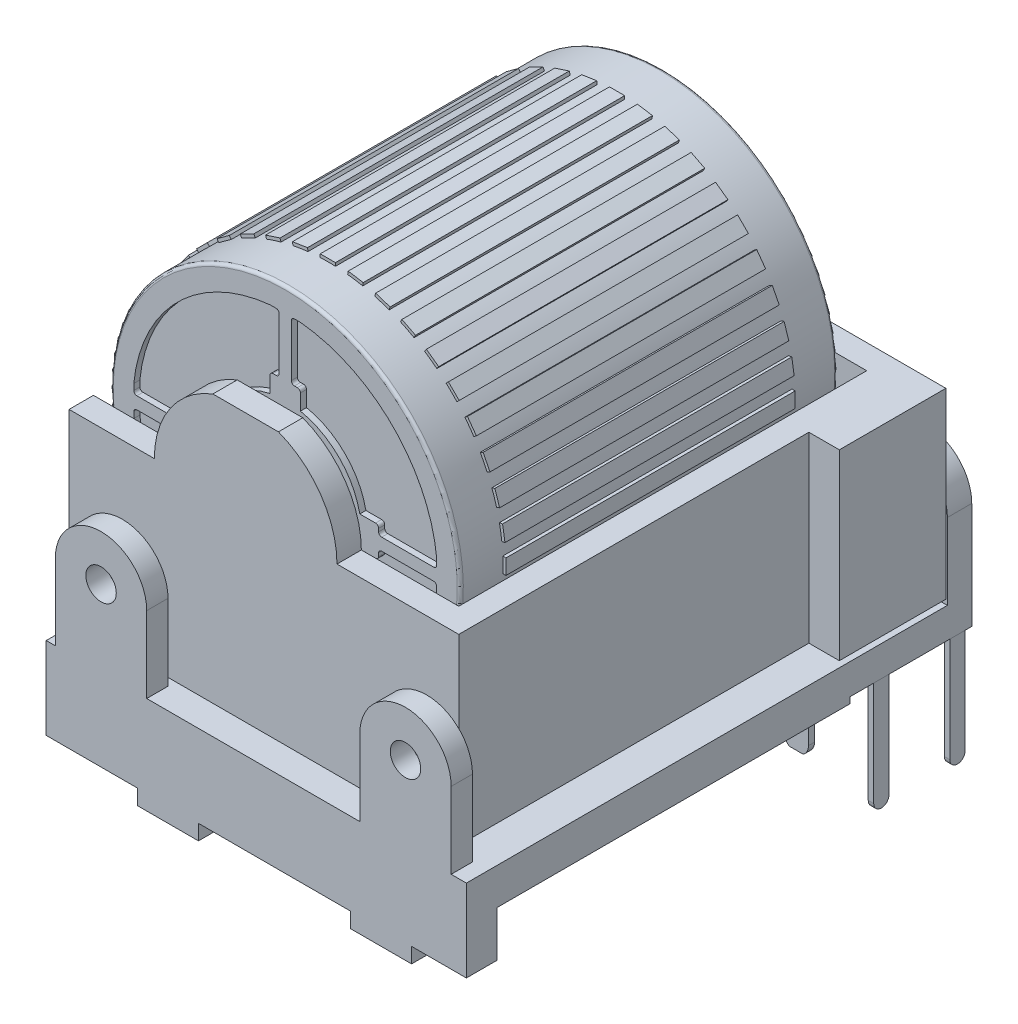
from build123d import *

# Parameters (mm, degrees)
SKETCH_1_W          = 13.8
SKETCH_1_H          = 16.6
EXTRUDE_1_DEPTH     = 1.2
SKETCH_2_W          = 13.8
SKETCH_2_H          = 1
EXTRUDE_2_DEPTH     = 1.5
SKETCH_3_W          = 2
SKETCH_3_H          = 2.2
EXTRUDE_3_DEPTH     = 0.5
SKETCH_4_R          = 0.5
EXTRUDE_4_DEPTH     = 0.7
SKETCH_5_R          = 0.5
EXTRUDE_5_DEPTH     = 0.8
CUT_EXTRUDE_1_DEPTH = 23.204504048
SKETCH_7_W          = 1.3
SKETCH_7_H          = 4
CUT_EXTRUDE_2_DEPTH = 0.2
CUT_EXTRUDE_3_DEPTH = 23.158519806
SKETCH_9_W          = 0.18
SKETCH_9_H          = 0.5
EXTRUDE_6_DEPTH     = 3.7
CUT_EXTRUDE_5_DEPTH = 3.7
CUT_EXTRUDE_4_DEPTH = 3.7
SKETCH_12_R         = 0.5
EXTRUDE_7_DEPTH     = 0.2
EXTRUDE_8_DEPTH     = 6
SKETCH_14_W         = 12
SKETCH_14_H         = 13.4
CUT_EXTRUDE_6_DEPTH = 2.8
SKETCH_15_R         = 0.6
EXTRUDE_9_DEPTH     = 1.2
FILLET_1_R          = 0.1
EXTRUDE_10_DEPTH    = 0.8
EXTRUDE_START       = -0.8
EXTRUDE_11_DEPTH    = 0.8
SKETCH_18_R         = 2
EXTRUDE_12_DEPTH    = 0.5
EXTRUDE_START_2     = 0.5
SKETCH_19_R         = 2
EXTRUDE_13_DEPTH    = 0.5
SKETCH_20_R         = 5.75
EXTRUDE_14_DEPTH    = 12.4
FILLET_2_R          = 0.1
FILLET_3_R          = 0.1
SKETCH_21_R         = 4.85
SKETCH_21_R_2       = 4
EXTRUDE_15_DEPTH    = 0.1
SKETCH_22_R         = 4
EXTRUDE_16_DEPTH    = 0.2
CUT_EXTRUDE_7_DEPTH = 0.2
EXTRUDE_17_DEPTH    = 9.5


with BuildPart() as part:
    # 草图1 → 凸台-拉伸1 (new body)
    with BuildSketch(Plane(origin=(0, 0, 0), x_dir=(1, 0, 0), z_dir=(0, 1, 0))):
        with Locations((6.9, 8.3)):
            Rectangle(SKETCH_1_W, SKETCH_1_H)
    extrude(amount=EXTRUDE_1_DEPTH)

    # 草图2 → 凸台-拉伸2 (add)
    with BuildSketch(Plane.XZ):
        with Locations((6.9, -0.5)):
            Rectangle(SKETCH_2_W, SKETCH_2_H)
    extrude(amount=EXTRUDE_2_DEPTH)

    # 草图3 → 凸台-拉伸3 (add)
    with BuildSketch(Plane.XZ.offset(1.5)):
        with Locations((11, -1.1)):
            Rectangle(SKETCH_3_W, SKETCH_3_H)
        with Locations((4, -1.1)):
            Rectangle(SKETCH_3_W, SKETCH_3_H)
    extrude(amount=EXTRUDE_3_DEPTH)

    # 草图4 → 凸台-拉伸4 (add)
    # profile 1 of 2: a face of its own
    with BuildSketch(Plane.XY):
        with BuildLine():
            Line((0.3, 1.2), (0.3, 3.7))
            ThreePointArc((0.3, 3.7), (1.8, 5.2), (3.3, 3.7))
            Line((3.3, 3.7), (3.3, 1.2))
            Line((3.3, 1.2), (0.3, 1.2))
        make_face()
        with Locations((1.8, 3.7)):
            Circle(SKETCH_4_R, mode=Mode.SUBTRACT)
    # profile 2 of 2: a face of its own
    with BuildSketch(Plane.XY):
        with BuildLine():
            Line((13.3, 1.2), (13.3, 3.7))
            ThreePointArc((13.3, 3.7), (11.8, 5.2), (10.3, 3.7))
            Line((10.3, 3.7), (10.3, 1.2))
            Line((10.3, 1.2), (13.3, 1.2))
        make_face()
        with Locations((11.8, 3.7)):
            Circle(SKETCH_4_R, mode=Mode.SUBTRACT)
    extrude(amount=-EXTRUDE_4_DEPTH)

    # 草图5 → 凸台-拉伸5 (add)
    with BuildSketch(Plane(origin=(0, 0, -16.6), x_dir=(-1, 0, 0), z_dir=(0, 0, -1))):
        with BuildLine():
            Line((-2, 1.2), (-2, 3.7))
            ThreePointArc((-2, 3.7), (-2.439339828, 4.760660172), (-3.5, 5.2))
            Line((-3.5, 5.2), (-12.3, 5.2))
            ThreePointArc((-12.3, 5.2), (-13.360660172, 4.760660172), (-13.8, 3.7))
            Line((-13.8, 3.7), (-13.8, 1.2))
            Line((-13.8, 1.2), (-2, 1.2))
        make_face()
        with Locations((-12.5, 3.7)):
            Circle(SKETCH_5_R, mode=Mode.SUBTRACT)
        with Locations((-3.3, 3.7)):
            Circle(SKETCH_5_R, mode=Mode.SUBTRACT)
    extrude(amount=-EXTRUDE_5_DEPTH)

    # 草图6 → 切除-拉伸1 (cut, through all)
    with BuildSketch(Plane.XZ):
        Polygon((11, -2.7), (12.5, -2.7), (12.5, -1), (9.5, -1), (9.5, -2.7), align=None)
        Polygon((4, -2.7), (5.5, -2.7), (5.5, -1), (2.5, -1), (2.5, -2.7), align=None)
    extrude(amount=-CUT_EXTRUDE_1_DEPTH, mode=Mode.SUBTRACT)

    # 草图7 → 切除-拉伸2 (cut)
    with BuildSketch(Plane.XZ):
        with Locations((13.15, -14.6)):
            Rectangle(SKETCH_7_W, SKETCH_7_H)
        Polygon((2, -14.8), (2, -11.3), (10, -11.3), (10, -12.3), (12, -12.3), (12, -14.8), align=None)
    extrude(amount=-CUT_EXTRUDE_2_DEPTH, mode=Mode.SUBTRACT)

    # 草图8 → 切除-拉伸3 (cut, through all)
    with BuildSketch(Plane.XZ.offset(-0.2)):
        Polygon((2, -13.05), (12, -13.05), (12, -12.3), (10, -12.3), (10, -11.3), (2, -11.3), align=None)
    extrude(amount=-CUT_EXTRUDE_3_DEPTH, mode=Mode.SUBTRACT)

    # 草图9 → 凸台-拉伸6 (add)
    with BuildSketch(Plane.XZ.offset(-0.2)):
        Polygon((10.81, -14.025), (11.21, -14.025), (11.21, -13.825), (10.41, -13.825), (10.41, -14.025), align=None)
        with Locations((13.69, -16.15)):
            Rectangle(SKETCH_9_W, SKETCH_9_H)
        Polygon((8.27, -14.025), (8.67, -14.025), (8.67, -13.825), (7.87, -13.825), (7.87, -14.025), align=None)
        Polygon((5.73, -14.025), (6.13, -14.025), (6.13, -13.825), (5.33, -13.825), (5.33, -14.025), align=None)
        with Locations((13.69, -13.65)):
            Rectangle(SKETCH_9_W, SKETCH_9_H)
        Polygon((3.19, -14.025), (3.59, -14.025), (3.59, -13.825), (2.79, -13.825), (2.79, -14.025), align=None)
    extrude(amount=EXTRUDE_6_DEPTH)

    # 草图11 → 切除-拉伸5 (cut)
    with BuildSketch(Plane(origin=(13.78, 0, 0), x_dir=(0, 0, -1), z_dir=(1, 0, 0))):
        with BuildLine():
            ThreePointArc((13.65, -3.5), (13.473223305, -3.426776695), (13.4, -3.25))
            Line((13.4, -3.25), (13.4, -3.5))
            Line((13.4, -3.5), (13.65, -3.5))
        make_face()
        with BuildLine():
            ThreePointArc((13.9, -3.25), (13.826776695, -3.426776695), (13.65, -3.5))
            Line((13.65, -3.5), (13.9, -3.5))
            Line((13.9, -3.5), (13.9, -3.25))
        make_face()
        with BuildLine():
            ThreePointArc((16.15, -3.5), (15.973223305, -3.426776695), (15.9, -3.25))
            Line((15.9, -3.25), (15.9, -3.5))
            Line((15.9, -3.5), (16.15, -3.5))
        make_face()
        with BuildLine():
            ThreePointArc((16.4, -3.25), (16.326776695, -3.426776695), (16.15, -3.5))
            Line((16.15, -3.5), (16.4, -3.5))
            Line((16.4, -3.5), (16.4, -3.25))
        make_face()
    extrude(amount=-CUT_EXTRUDE_5_DEPTH, mode=Mode.SUBTRACT)

    # 草图10 → 切除-拉伸4 (cut)
    with BuildSketch(Plane(origin=(0, 0, -14.025), x_dir=(-1, 0, 0), z_dir=(0, 0, -1))):
        with BuildLine():
            ThreePointArc((-10.81, -3.5), (-11.092842712, -3.382842712), (-11.21, -3.1))
            Line((-11.21, -3.1), (-11.21, -3.5))
            Line((-11.21, -3.5), (-10.81, -3.5))
        make_face()
        with BuildLine():
            ThreePointArc((-10.41, -3.1), (-10.527157288, -3.382842712), (-10.81, -3.5))
            Line((-10.81, -3.5), (-10.41, -3.5))
            Line((-10.41, -3.5), (-10.41, -3.1))
        make_face()
        with BuildLine():
            ThreePointArc((-5.33, -3.1), (-5.447157288, -3.382842712), (-5.73, -3.5))
            Line((-5.73, -3.5), (-5.33, -3.5))
            Line((-5.33, -3.5), (-5.33, -3.1))
        make_face()
        with BuildLine():
            ThreePointArc((-5.73, -3.5), (-6.012842712, -3.382842712), (-6.13, -3.1))
            Line((-6.13, -3.1), (-6.13, -3.5))
            Line((-6.13, -3.5), (-5.73, -3.5))
        make_face()
        with BuildLine():
            ThreePointArc((-2.79, -3.1), (-2.907157288, -3.382842712), (-3.19, -3.5))
            Line((-3.19, -3.5), (-2.79, -3.5))
            Line((-2.79, -3.5), (-2.79, -3.1))
        make_face()
        with BuildLine():
            ThreePointArc((-3.19, -3.5), (-3.472842712, -3.382842712), (-3.59, -3.1))
            Line((-3.59, -3.1), (-3.59, -3.5))
            Line((-3.59, -3.5), (-3.19, -3.5))
        make_face()
        with BuildLine():
            Line((-8.67, -3.1), (-8.67, -3.5))
            Line((-8.67, -3.5), (-8.27, -3.5))
            ThreePointArc((-8.27, -3.5), (-8.552842712, -3.382842712), (-8.67, -3.1))
        make_face()
        with BuildLine():
            ThreePointArc((-8.27, -3.5), (-7.987157288, -3.382842712), (-7.87, -3.1))
            Line((-7.87, -3.1), (-7.87, -3.5))
            Line((-7.87, -3.5), (-8.27, -3.5))
        make_face()
    extrude(amount=-CUT_EXTRUDE_4_DEPTH, mode=Mode.SUBTRACT)

    # 草图12 → 凸台-拉伸7 (add)
    with BuildSketch(Plane(origin=(0, 1.2, 0), x_dir=(1, 0, 0), z_dir=(0, 1, 0))):
        with Locations(Location((6.727077824, 7.591019079, 0), (0, 0, 270))):
            Circle(SKETCH_12_R)
    extrude(amount=EXTRUDE_7_DEPTH)

    # 草图13 → 凸台-拉伸8 (add)
    with BuildSketch(Plane(origin=(0, 1.4, 0), x_dir=(1, 0, 0), z_dir=(0, 1, 0))):
        Polygon((0, 15.75), (13.8, 15.75), (13.8, 12.25), (12.8, 12.25), (12.8, 0.75), (0, 0.75), align=None)
    extrude(amount=EXTRUDE_8_DEPTH)

    # 草图14 → 切除-拉伸6 (cut)
    with BuildSketch(Plane(origin=(0, 7.4, 0), x_dir=(1, 0, 0), z_dir=(0, 1, 0))):
        with Locations((6, 8.25)):
            Rectangle(SKETCH_14_W, SKETCH_14_H)
    extrude(amount=-CUT_EXTRUDE_6_DEPTH, mode=Mode.SUBTRACT)

    # 草图15 → 凸台-拉伸9 (add)
    with BuildSketch(Plane.XZ):
        with Locations(Location((1, -14.1, 0), (0, 0, 90))):
            Circle(SKETCH_15_R)
    extrude(amount=EXTRUDE_9_DEPTH)

    # 圆角1
    fillet_1_edges = [part.edges().sort_by_distance(p)[0] for p in [
        (1, -1.2, -14.7),
    ]]
    fillet(fillet_1_edges, radius=FILLET_1_R)

    # 草图16 → 凸台-拉伸10 (add)
    with BuildSketch(Plane(origin=(0, 0, -15.75), x_dir=(-1, 0, 0), z_dir=(0, 0, -1))):
        with BuildLine():
            Line((-5.8, 7.4), (-8.8, 7.4))
            ThreePointArc((-8.8, 7.4), (-8.272963696, 9.098367027), (-6.877032961, 10.2))
            Line((-6.877032961, 10.2), (-4.722967039, 10.2))
            ThreePointArc((-4.722967039, 10.2), (-3.327036304, 9.098367027), (-2.8, 7.4))
            Line((-2.8, 7.4), (-5.8, 7.4))
        make_face()
    extrude(amount=-EXTRUDE_10_DEPTH)

    # 草图17 → 凸台-拉伸11 (add)
    with BuildSketch(Plane.XY.offset(-0.75).offset(EXTRUDE_START)):
        with BuildLine():
            Line((2.8, 7.4), (8.8, 7.4))
            ThreePointArc((8.8, 7.4), (8.272963696, 9.098367027), (6.877032961, 10.2))
            Line((6.877032961, 10.2), (4.722967039, 10.2))
            ThreePointArc((4.722967039, 10.2), (3.327036304, 9.098367027), (2.8, 7.4))
        make_face()
    extrude(amount=EXTRUDE_11_DEPTH)

    # 草图18 → 凸台-拉伸12 (add)
    with BuildSketch(Plane.XY.offset(-14.95)):
        with Locations(Location((5.8, 7.4, 0), (0, 0, 180))):
            Circle(SKETCH_18_R)
    extrude(amount=EXTRUDE_12_DEPTH)

    # 草图19 → 凸台-拉伸13 (add)
    with BuildSketch(Plane(origin=(0, 0, -1.55), x_dir=(-1, 0, 0), z_dir=(0, 0, -1)).offset(EXTRUDE_START_2)):
        with Locations((-5.8, 7.4)):
            Circle(SKETCH_19_R)
    extrude(amount=-EXTRUDE_13_DEPTH)

    # 草图20 → 凸台-拉伸14 (add)
    with BuildSketch(Plane(origin=(0, 0, -2.05), x_dir=(-1, 0, 0), z_dir=(0, 0, -1))):
        with Locations((-5.8, 7.4)):
            Circle(SKETCH_20_R)
    extrude(amount=EXTRUDE_14_DEPTH)

    # 圆角2
    fillet_2_edges = [part.edges().sort_by_distance(p)[0] for p in [
        (5.8, 13.15, -14.45),
    ]]
    fillet(fillet_2_edges, radius=FILLET_2_R)

    # 圆角3
    fillet_3_edges = [part.edges().sort_by_distance(p)[0] for p in [
        (5.8, 13.15, -2.05),
    ]]
    fillet(fillet_3_edges, radius=FILLET_3_R)

    # 草图21 → 凸台-拉伸15 (add)
    with BuildSketch(Plane(origin=(0, 0, -14.45), x_dir=(-1, 0, 0), z_dir=(0, 0, -1))):
        with Locations((-5.8, 7.4)):
            Circle(SKETCH_21_R)
        with Locations((-5.8, 7.4)):
            Circle(SKETCH_21_R_2, mode=Mode.SUBTRACT)
    extrude(amount=EXTRUDE_15_DEPTH)

    # 草图22 → 凸台-拉伸16 (add)
    with BuildSketch(Plane(origin=(0, 0, -14.45), x_dir=(-1, 0, 0), z_dir=(0, 0, -1))):
        with Locations((-5.8, 7.4)):
            Circle(SKETCH_22_R)
    extrude(amount=EXTRUDE_16_DEPTH)

    # 草图23 → 切除-拉伸7 (cut)
    with BuildSketch(Plane.XY.offset(-2.05)):
        with BuildLine():
            Line((5.400625391, 10.467363641), (5.5, 10.467363641))
            ThreePointArc((5.5, 10.467363641), (5.570710678, 10.496652963), (5.6, 10.567363641))
            Line((5.6, 10.567363641), (5.6, 12.275))
            ThreePointArc((5.6, 12.275), (5.570710678, 12.345710678), (5.5, 12.375))
            Line((5.5, 12.375), (5.300625391, 12.375))
            ThreePointArc((5.300625391, 12.375), (2.264466094, 10.935533906), (0.825, 7.899374609))
            Line((0.825, 7.899374609), (0.825, 7.7))
            ThreePointArc((0.825, 7.7), (0.854289322, 7.629289322), (0.925, 7.6))
            Line((0.925, 7.6), (2.632636359, 7.6))
            ThreePointArc((2.632636359, 7.6), (2.703347037, 7.629289322), (2.732636359, 7.7))
            Line((2.732636359, 7.7), (2.732636359, 7.799374609))
            ThreePointArc((2.732636359, 7.799374609), (2.76192568, 7.870085287), (2.832636359, 7.899374609))
            Line((2.832636359, 7.899374609), (3.350382683, 7.899374609))
            ThreePointArc((3.350382683, 7.899374609), (4.032233047, 9.167766953), (5.300625391, 9.849617317))
            Line((5.300625391, 9.849617317), (5.300625391, 10.367363641))
            ThreePointArc((5.300625391, 10.367363641), (5.329914713, 10.43807432), (5.400625391, 10.467363641))
        make_face()
        with BuildLine():
            Line((6.1, 10.467363641), (6.199374609, 10.467363641))
            ThreePointArc((6.199374609, 10.467363641), (6.270085287, 10.43807432), (6.299374609, 10.367363641))
            Line((6.299374609, 10.367363641), (6.299374609, 9.849617317))
            ThreePointArc((6.299374609, 9.849617317), (7.567766953, 9.167766953), (8.249617317, 7.899374609))
            Line((8.249617317, 7.899374609), (8.767363641, 7.899374609))
            ThreePointArc((8.767363641, 7.899374609), (8.83807432, 7.870085287), (8.867363641, 7.799374609))
            Line((8.867363641, 7.799374609), (8.867363641, 7.7))
            ThreePointArc((8.867363641, 7.7), (8.896652963, 7.629289322), (8.967363641, 7.6))
            Line((8.967363641, 7.6), (10.675, 7.6))
            ThreePointArc((10.675, 7.6), (10.745710678, 7.629289322), (10.775, 7.7))
            Line((10.775, 7.7), (10.775, 7.899374609))
            ThreePointArc((10.775, 7.899374609), (9.335533906, 10.935533906), (6.299374609, 12.375))
            Line((6.299374609, 12.375), (6.1, 12.375))
            ThreePointArc((6.1, 12.375), (6.029289322, 12.345710678), (6, 12.275))
            Line((6, 12.275), (6, 10.567363641))
            ThreePointArc((6, 10.567363641), (6.029289322, 10.496652963), (6.1, 10.467363641))
        make_face()
        with BuildLine():
            Line((0.925, 7.2), (2.632636359, 7.2))
            ThreePointArc((2.632636359, 7.2), (2.703347037, 7.170710678), (2.732636359, 7.1))
            Line((2.732636359, 7.1), (2.732636359, 7.000625391))
            ThreePointArc((2.732636359, 7.000625391), (2.76192568, 6.929914713), (2.832636359, 6.900625391))
            Line((2.832636359, 6.900625391), (3.350382683, 6.900625391))
            ThreePointArc((3.350382683, 6.900625391), (5.8, 4.9), (8.249617317, 6.900625391))
            Line((8.249617317, 6.900625391), (8.767363641, 6.900625391))
            ThreePointArc((8.767363641, 6.900625391), (8.83807432, 6.929914713), (8.867363641, 7.000625391))
            Line((8.867363641, 7.000625391), (8.867363641, 7.1))
            ThreePointArc((8.867363641, 7.1), (8.896652963, 7.170710678), (8.967363641, 7.2))
            Line((8.967363641, 7.2), (10.675, 7.2))
            ThreePointArc((10.675, 7.2), (10.745710678, 7.170710678), (10.775, 7.1))
            Line((10.775, 7.1), (10.775, 6.900625391))
            ThreePointArc((10.775, 6.900625391), (5.8, 2.4), (0.825, 6.900625391))
            Line((0.825, 6.900625391), (0.825, 7.1))
            ThreePointArc((0.825, 7.1), (0.854289322, 7.170710678), (0.925, 7.2))
        make_face()
    extrude(amount=-CUT_EXTRUDE_7_DEPTH, mode=Mode.SUBTRACT)

    # 草图24 → 凸台-拉伸17 (add)
    with BuildSketch(Plane(origin=(0, 0, -12.95), x_dir=(-1, 0, 0), z_dir=(0, 0, -1))):
        Polygon((-4.65443033, 13.034728932), (-5.148274501, 13.112946164), (-5.131780465, 13.217085409), (-4.88485838, 13.177976792), (-4.637936294, 13.138868176), align=None)
        Polygon((-5.8, 13.25), (-6.05, 13.25), (-6.05, 13.144562647), (-5.55, 13.144562647), (-5.55, 13.25), align=None)
        Polygon((-3.787068388, 12.78614949), (-4.262596646, 12.940657987), (-4.230014712, 13.040934869), (-3.992250583, 12.96368062), (-3.754486454, 12.886426372), align=None)
        Polygon((-2.969271502, 12.404945172), (-3.414774764, 12.631940422), (-3.366907208, 12.725885791), (-3.144155577, 12.612388167), (-2.921403945, 12.498890542), align=None)
        Polygon((-2.221176547, 11.900502493), (-2.625685044, 12.194395119), (-2.563710523, 12.27969573), (-2.361456274, 12.132749417), (-2.159202025, 11.985803104), align=None)
        Polygon((-1.561204102, 11.285242507), (-1.914757493, 11.638795898), (-1.840202025, 11.713351365), (-1.66342533, 11.53657467), (-1.486648635, 11.359797975), align=None)
        Polygon((-1.005604881, 10.574314956), (-1.299497507, 10.978823453), (-1.214196896, 11.040797975), (-1.067250583, 10.838543726), (-0.92030427, 10.636289477), align=None)
        Polygon((-0.568059578, 9.785225236), (-0.795054828, 10.230728498), (-0.701109458, 10.278596055), (-0.587611833, 10.055844423), (-0.474114209, 9.833092792), align=None)
        Polygon((-0.259342013, 8.937403354), (-0.41385051, 9.412931612), (-0.313573628, 9.445513546), (-0.23631938, 9.207749417), (-0.159065131, 8.969985288), align=None)
        Polygon((-0.087053836, 8.051725499), (-0.165271068, 8.54556967), (-0.061131824, 8.562063706), (-0.022023208, 8.31514162), (0.017085409, 8.068219535), align=None)
        Polygon((-0.055437353, 7.15), (-0.055437353, 7.65), (0.05, 7.65), (0.05, 7.4), (0.05, 7.15), align=None)
        Polygon((-0.165271068, 6.25443033), (-0.087053836, 6.748274501), (0.017085409, 6.731780465), (-0.022023208, 6.48485838), (-0.061131824, 6.237936294), align=None)
        Polygon((-0.41385051, 5.387068388), (-0.259342013, 5.862596646), (-0.159065131, 5.830014712), (-0.23631938, 5.592250583), (-0.313573628, 5.354486454), align=None)
        Polygon((-0.795054828, 4.569271502), (-0.568059578, 5.014774764), (-0.474114209, 4.966907208), (-0.587611833, 4.744155577), (-0.701109458, 4.521403945), align=None)
        Polygon((-1.299497507, 3.821176547), (-1.005604881, 4.225685044), (-0.92030427, 4.163710523), (-1.067250583, 3.961456274), (-1.214196896, 3.759202025), align=None)
        Polygon((-1.914757493, 3.161204102), (-1.561204102, 3.514757493), (-1.486648635, 3.440202025), (-1.66342533, 3.26342533), (-1.840202025, 3.086648635), align=None)
        Polygon((-2.625685044, 2.605604881), (-2.221176547, 2.899497507), (-2.159202025, 2.814196896), (-2.361456274, 2.667250583), (-2.563710523, 2.52030427), align=None)
        Polygon((-3.414774764, 2.168059578), (-2.969271502, 2.395054828), (-2.921403945, 2.301109458), (-3.144155577, 2.187611833), (-3.366907208, 2.074114209), align=None)
        Polygon((-4.262596646, 1.859342013), (-3.787068388, 2.01385051), (-3.754486454, 1.913573628), (-3.992250583, 1.83631938), (-4.230014712, 1.759065131), align=None)
        Polygon((-5.148274501, 1.687053836), (-4.65443033, 1.765271068), (-4.637936294, 1.661131824), (-4.88485838, 1.622023208), (-5.131780465, 1.582914591), align=None)
        Polygon((-6.05, 1.655437353), (-5.55, 1.655437353), (-5.55, 1.55), (-5.8, 1.55), (-6.05, 1.55), align=None)
        Polygon((-6.94556967, 1.765271068), (-6.451725499, 1.687053836), (-6.468219535, 1.582914591), (-6.71514162, 1.622023208), (-6.962063706, 1.661131824), align=None)
        Polygon((-7.812931612, 2.01385051), (-7.337403354, 1.859342013), (-7.369985288, 1.759065131), (-7.607749417, 1.83631938), (-7.845513546, 1.913573628), align=None)
        Polygon((-8.630728498, 2.395054828), (-8.185225236, 2.168059578), (-8.233092792, 2.074114209), (-8.455844423, 2.187611833), (-8.678596055, 2.301109458), align=None)
        Polygon((-9.378823453, 2.899497507), (-8.974314956, 2.605604881), (-9.036289477, 2.52030427), (-9.238543726, 2.667250583), (-9.440797975, 2.814196896), align=None)
        Polygon((-10.038795898, 3.514757493), (-9.685242507, 3.161204102), (-9.759797975, 3.086648635), (-9.93657467, 3.26342533), (-10.113351365, 3.440202025), align=None)
        Polygon((-10.594395119, 4.225685044), (-10.300502493, 3.821176547), (-10.385803104, 3.759202025), (-10.532749417, 3.961456274), (-10.67969573, 4.163710523), align=None)
        Polygon((-11.031940422, 5.014774764), (-10.804945172, 4.569271502), (-10.898890542, 4.521403945), (-11.012388167, 4.744155577), (-11.125885791, 4.966907208), align=None)
        Polygon((-11.340657987, 5.862596646), (-11.18614949, 5.387068388), (-11.286426372, 5.354486454), (-11.36368062, 5.592250583), (-11.440934869, 5.830014712), align=None)
        Polygon((-11.512946164, 6.748274501), (-11.434728932, 6.25443033), (-11.538868176, 6.237936294), (-11.577976792, 6.48485838), (-11.617085409, 6.731780465), align=None)
        Polygon((-11.544562647, 7.65), (-11.544562647, 7.15), (-11.65, 7.15), (-11.65, 7.4), (-11.65, 7.65), align=None)
        Polygon((-11.434728932, 8.54556967), (-11.512946164, 8.051725499), (-11.617085409, 8.068219535), (-11.577976792, 8.31514162), (-11.538868176, 8.562063706), align=None)
        Polygon((-11.18614949, 9.412931612), (-11.340657987, 8.937403354), (-11.440934869, 8.969985288), (-11.36368062, 9.207749417), (-11.286426372, 9.445513546), align=None)
        Polygon((-10.804945172, 10.230728498), (-11.031940422, 9.785225236), (-11.125885791, 9.833092792), (-11.012388167, 10.055844423), (-10.898890542, 10.278596055), align=None)
        Polygon((-10.300502493, 10.978823453), (-10.594395119, 10.574314956), (-10.67969573, 10.636289477), (-10.532749417, 10.838543726), (-10.385803104, 11.040797975), align=None)
        Polygon((-9.685242507, 11.638795898), (-10.038795898, 11.285242507), (-10.113351365, 11.359797975), (-9.93657467, 11.53657467), (-9.759797975, 11.713351365), align=None)
        Polygon((-8.974314956, 12.194395119), (-9.378823453, 11.900502493), (-9.440797975, 11.985803104), (-9.238543726, 12.132749417), (-9.036289477, 12.27969573), align=None)
        Polygon((-8.185225236, 12.631940422), (-8.630728498, 12.404945172), (-8.678596055, 12.498890542), (-8.455844423, 12.612388167), (-8.233092792, 12.725885791), align=None)
        Polygon((-7.337403354, 12.940657987), (-7.812931612, 12.78614949), (-7.845513546, 12.886426372), (-7.607749417, 12.96368062), (-7.369985288, 13.040934869), align=None)
        Polygon((-6.451725499, 13.112946164), (-6.94556967, 13.034728932), (-6.962063706, 13.138868176), (-6.71514162, 13.177976792), (-6.468219535, 13.217085409), align=None)
    extrude(amount=-EXTRUDE_17_DEPTH)


solid = part.part
